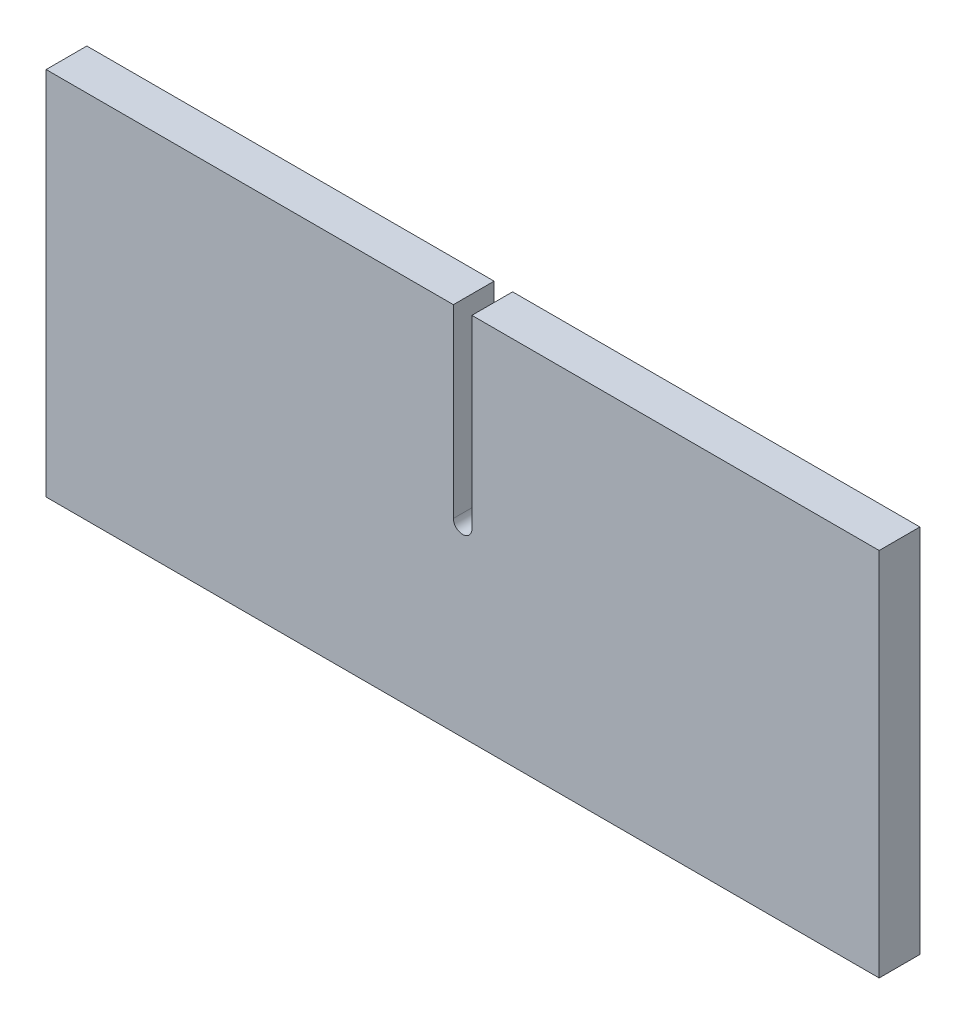
from build123d import *

# Parameters (mm, degrees)
BOSS_EXTRUDE1_DEPTH = 22


with BuildPart() as part:
    # Sketch1 → Boss-Extrude1 (new body)
    with BuildSketch(Plane.XY):
        with BuildLine():
            Line((5, 100), (5, 0))
            ThreePointArc((5, 0), (0, -5), (-5, 0))
            Line((-5, 0), (-5, 100))
            Line((-5, 100), (-225, 100))
            Line((-225, 100), (-225, -100))
            Line((-225, -100), (225, -100))
            Line((225, -100), (225, 100))
            Line((225, 100), (5, 100))
        make_face()
    extrude(amount=BOSS_EXTRUDE1_DEPTH)


solid = part.part
